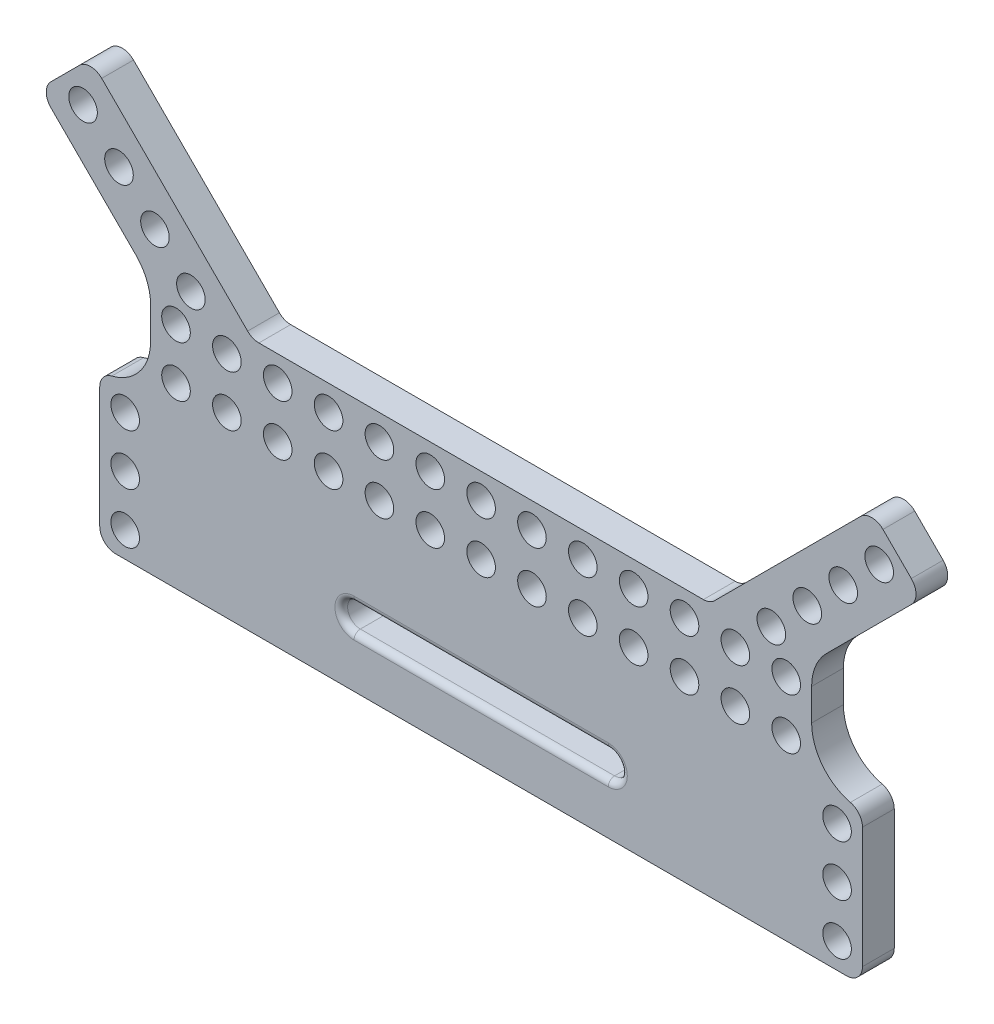
from build123d import *

# Parameters (mm, degrees)
SKETCH_1_R      = 2.25
EXTRUDE_1_DEPTH = 5
FILLET_1_R      = 2.5
FILLET_2_R      = 1
FILLET_3_R      = 8


with BuildPart() as part:
    # 草图1 → 凸台-拉伸1 (new body)
    with BuildSketch(Plane.XY):
        Polygon((-60, 4), (-60, -20), (60, -20), (60, 4), (52, 4), (52, 20), (69.455844123, 37.455844123), (61.455844123, 45.455844123), (36, 20), (-36, 20), (-61.455844123, 45.455844123), (-69.455844123, 37.455844123), (-52, 20), (-52, 4), align=None)
        with Locations((-56, -16)):
            Circle(SKETCH_1_R, mode=Mode.SUBTRACT)
        with Locations((-56, -8)):
            Circle(SKETCH_1_R, mode=Mode.SUBTRACT)
        with Locations((-56, 0)):
            Circle(SKETCH_1_R, mode=Mode.SUBTRACT)
        with Locations((56, 0)):
            Circle(SKETCH_1_R, mode=Mode.SUBTRACT)
        with Locations((56, -16)):
            Circle(SKETCH_1_R, mode=Mode.SUBTRACT)
        with Locations((56, -8)):
            Circle(SKETCH_1_R, mode=Mode.SUBTRACT)
        with Locations((-48, 16)):
            Circle(SKETCH_1_R, mode=Mode.SUBTRACT)
        with Locations((-48, 8)):
            Circle(SKETCH_1_R, mode=Mode.SUBTRACT)
        with Locations((-40, 16)):
            Circle(SKETCH_1_R, mode=Mode.SUBTRACT)
        with Locations((-40, 8)):
            Circle(SKETCH_1_R, mode=Mode.SUBTRACT)
        with Locations((-32, 16)):
            Circle(SKETCH_1_R, mode=Mode.SUBTRACT)
        with Locations((-32, 8)):
            Circle(SKETCH_1_R, mode=Mode.SUBTRACT)
        with Locations((-24, 16)):
            Circle(SKETCH_1_R, mode=Mode.SUBTRACT)
        with Locations((-24, 8)):
            Circle(SKETCH_1_R, mode=Mode.SUBTRACT)
        with Locations((-16, 16)):
            Circle(SKETCH_1_R, mode=Mode.SUBTRACT)
        with Locations((-16, 8)):
            Circle(SKETCH_1_R, mode=Mode.SUBTRACT)
        with Locations((-8, 16)):
            Circle(SKETCH_1_R, mode=Mode.SUBTRACT)
        with Locations((-8, 8)):
            Circle(SKETCH_1_R, mode=Mode.SUBTRACT)
        with Locations((0, 16)):
            Circle(SKETCH_1_R, mode=Mode.SUBTRACT)
        with Locations((0, 8)):
            Circle(SKETCH_1_R, mode=Mode.SUBTRACT)
        with Locations((8, 16)):
            Circle(SKETCH_1_R, mode=Mode.SUBTRACT)
        with Locations((8, 8)):
            Circle(SKETCH_1_R, mode=Mode.SUBTRACT)
        with Locations((16, 16)):
            Circle(SKETCH_1_R, mode=Mode.SUBTRACT)
        with Locations((16, 8)):
            Circle(SKETCH_1_R, mode=Mode.SUBTRACT)
        with Locations((24, 16)):
            Circle(SKETCH_1_R, mode=Mode.SUBTRACT)
        with Locations((24, 8)):
            Circle(SKETCH_1_R, mode=Mode.SUBTRACT)
        with Locations((32, 16)):
            Circle(SKETCH_1_R, mode=Mode.SUBTRACT)
        with Locations((32, 8)):
            Circle(SKETCH_1_R, mode=Mode.SUBTRACT)
        with Locations((40, 16)):
            Circle(SKETCH_1_R, mode=Mode.SUBTRACT)
        with Locations((40, 8)):
            Circle(SKETCH_1_R, mode=Mode.SUBTRACT)
        with Locations((48, 16)):
            Circle(SKETCH_1_R, mode=Mode.SUBTRACT)
        with Locations((48, 8)):
            Circle(SKETCH_1_R, mode=Mode.SUBTRACT)
        with Locations((-45.656854249, 21.656854249)):
            Circle(SKETCH_1_R, mode=Mode.SUBTRACT)
        with Locations((-51.313708499, 27.313708499)):
            Circle(SKETCH_1_R, mode=Mode.SUBTRACT)
        with Locations((-56.970562748, 32.970562748)):
            Circle(SKETCH_1_R, mode=Mode.SUBTRACT)
        with Locations((-62.627416998, 38.627416998)):
            Circle(SKETCH_1_R, mode=Mode.SUBTRACT)
        with Locations((45.656854249, 21.656854249)):
            Circle(SKETCH_1_R, mode=Mode.SUBTRACT)
        with Locations((51.313708499, 27.313708499)):
            Circle(SKETCH_1_R, mode=Mode.SUBTRACT)
        with Locations((56.970562748, 32.970562748)):
            Circle(SKETCH_1_R, mode=Mode.SUBTRACT)
        with Locations((62.627416998, 38.627416998)):
            Circle(SKETCH_1_R, mode=Mode.SUBTRACT)
        with BuildLine():
            Line((20, -8), (-20, -8))
            ThreePointArc((-20, -8), (-22, -10), (-20, -12))
            Line((-20, -12), (20, -12))
            ThreePointArc((20, -12), (22, -10), (20, -8))
        make_face(mode=Mode.SUBTRACT)
    extrude(amount=EXTRUDE_1_DEPTH)

    # 圆角1
    fillet_1_edges = [part.edges().sort_by_distance(p)[0] for p in [
        (60, 4, 2.5),
        (60, -20, 2.5),
        (-60, -20, 2.5),
        (-60, 4, 2.5),
        (-69.455844123, 37.455844123, 2.5),
        (-61.455844123, 45.455844123, 2.5),
        (-36, 20, 2.5),
        (36, 20, 2.5),
        (61.455844123, 45.455844123, 2.5),
        (69.455844123, 37.455844123, 2.5),
    ]]
    fillet(fillet_1_edges, radius=FILLET_1_R)

    # 圆角2
    fillet_2_edges = [part.edges().sort_by_distance(p)[0] for p in [
        (0, -8, 5),
        (22, -10, 5),
        (0, -12, 5),
        (-22, -10, 5),
    ]]
    fillet(fillet_2_edges, radius=FILLET_2_R)

    # 圆角3
    fillet_3_edges = [part.edges().sort_by_distance(p)[0] for p in [
        (-52, 4, 2.5),
        (-52, 20, 2.5),
        (52, 4, 2.5),
        (52, 20, 2.5),
    ]]
    fillet(fillet_3_edges, radius=FILLET_3_R)


solid = part.part
